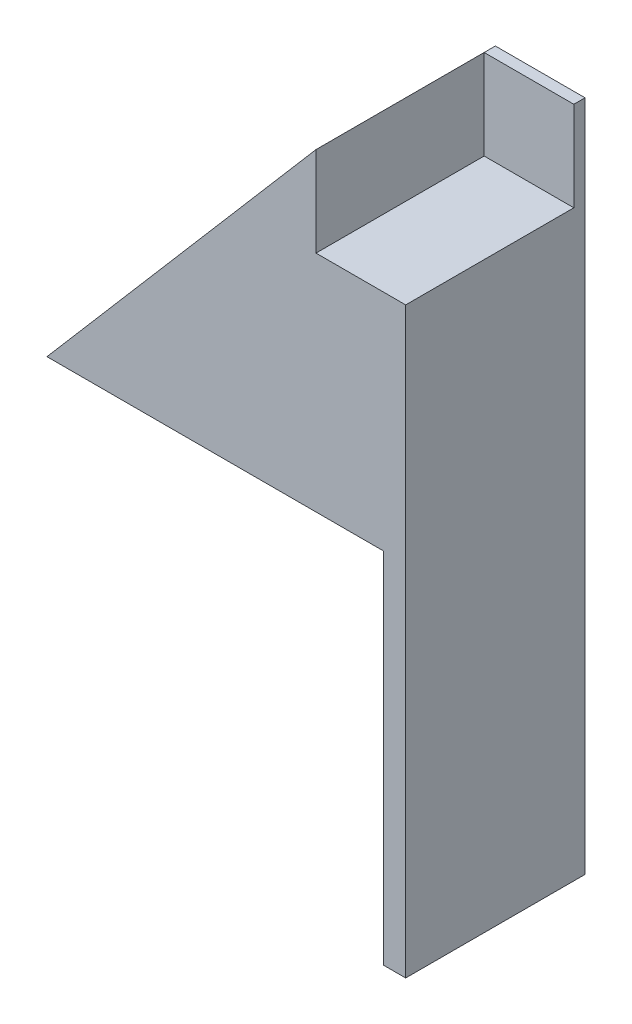
from build123d import *

# Parameters (mm, degrees)
BOSS_EXTRUDE1_DEPTH = 12.7
SKETCH2_W           = 12.7
SKETCH2_H           = 12.7
CUT_EXTRUDE1_DEPTH  = 23.8125


with BuildPart() as part:
    # Sketch1 → Boss-Extrude1 (new, symmetric)
    with BuildSketch(Plane.XY):
        Polygon((19.05, -50.8), (19.05, 0), (-28.575, 0), (9.525, 44.45), (22.225, 44.45), (22.225, 31.75), (22.225, -50.8), align=None)
    extrude(amount=BOSS_EXTRUDE1_DEPTH, both=True)

    # Sketch2 → Cut-Extrude1 (cut)
    with BuildSketch(Plane.XY.offset(12.7)):
        with Locations((15.875, 38.1)):
            Rectangle(SKETCH2_W, SKETCH2_H)
    extrude(amount=-CUT_EXTRUDE1_DEPTH, mode=Mode.SUBTRACT)


solid = part.part
